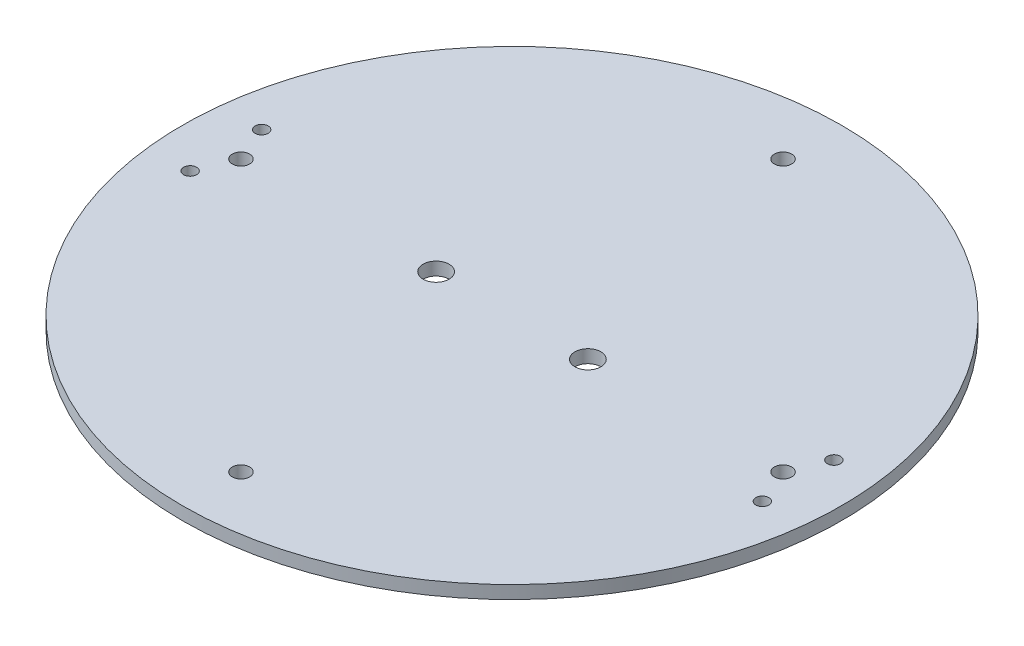
from build123d import *

# Parameters (mm, degrees)
SKETCH1_R           = 76
SKETCH1_R_2         = 1.5
SKETCH1_R_3         = 2
SKETCH1_R_4         = 3
BOSS_EXTRUDE1_DEPTH = 3


with BuildPart() as part:
    # Sketch1 → Boss-Extrude1 (new body)
    with BuildSketch(Plane(origin=(0, 0, 0), x_dir=(1, 0, 0), z_dir=(0, 1, 0))):
        with Locations(Location((0, 0, 0), (0, 0, 270))):
            Circle(SKETCH1_R)
        with Locations(Location((-65.979085433, -8.25, 0), (0, 0, 270))):
            Circle(SKETCH1_R_2, mode=Mode.SUBTRACT)
        with Locations(Location((-62.5, 0, 0), (0, 0, 270))):
            Circle(SKETCH1_R_3, mode=Mode.SUBTRACT)
        with Locations(Location((-65.979085433, 8.25, 0), (0, 0, 270))):
            Circle(SKETCH1_R_2, mode=Mode.SUBTRACT)
        with Locations(Location((65.979085433, 8.25, 0), (0, 0, 270))):
            Circle(SKETCH1_R_2, mode=Mode.SUBTRACT)
        with Locations(Location((65.979085433, -8.25, 0), (0, 0, 270))):
            Circle(SKETCH1_R_2, mode=Mode.SUBTRACT)
        with Locations(Location((0, 62.5, 0), (0, 0, 270))):
            Circle(SKETCH1_R_3, mode=Mode.SUBTRACT)
        with Locations(Location((62.5, 0, 0), (0, 0, 270))):
            Circle(SKETCH1_R_3, mode=Mode.SUBTRACT)
        with Locations(Location((0, -62.5, 0), (0, 0, 270))):
            Circle(SKETCH1_R_3, mode=Mode.SUBTRACT)
        with Locations(Location((17.5, 0, 0), (0, 0, 270))):
            Circle(SKETCH1_R_4, mode=Mode.SUBTRACT)
        with Locations(Location((-17.5, 0, 0), (0, 0, 270))):
            Circle(SKETCH1_R_4, mode=Mode.SUBTRACT)
    extrude(amount=BOSS_EXTRUDE1_DEPTH)


solid = part.part
